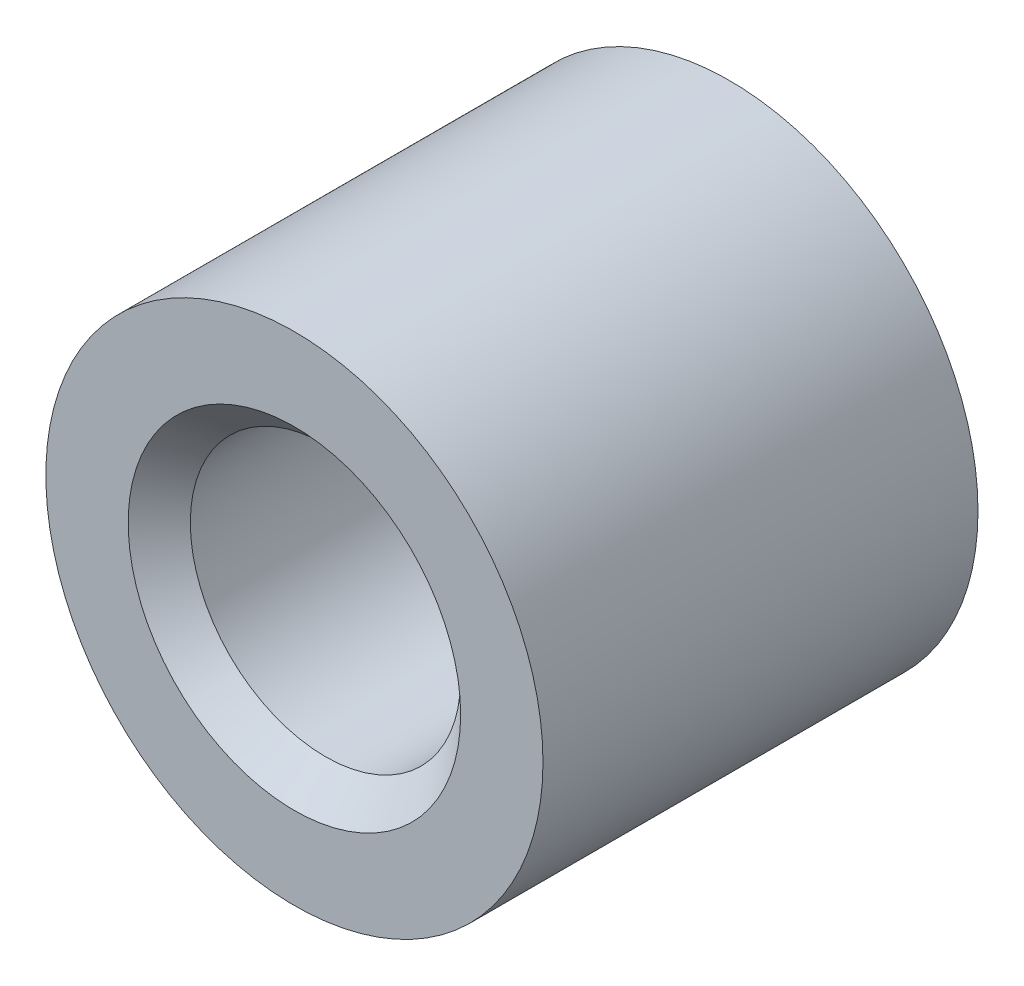
from build123d import *

# Parameters (mm, degrees)
SKETCH1_R           = 8
SKETCH1_R_2         = 4.35
BOSS_EXTRUDE1_DEPTH = 14
CHAMFER1_SIZE       = 1


with BuildPart() as part:
    # Sketch1 → Boss-Extrude1 (new body)
    with BuildSketch(Plane.XY):
        Circle(SKETCH1_R)
        Circle(SKETCH1_R_2, mode=Mode.SUBTRACT)
    extrude(amount=BOSS_EXTRUDE1_DEPTH)

    # Chamfer1
    chamfer1_edges = [part.edges().sort_by_distance(p)[0] for p in [
        (-4.35, 0, 0),
        (-4.35, 0, 14),
    ]]
    chamfer(chamfer1_edges, length=CHAMFER1_SIZE)


solid = part.part
